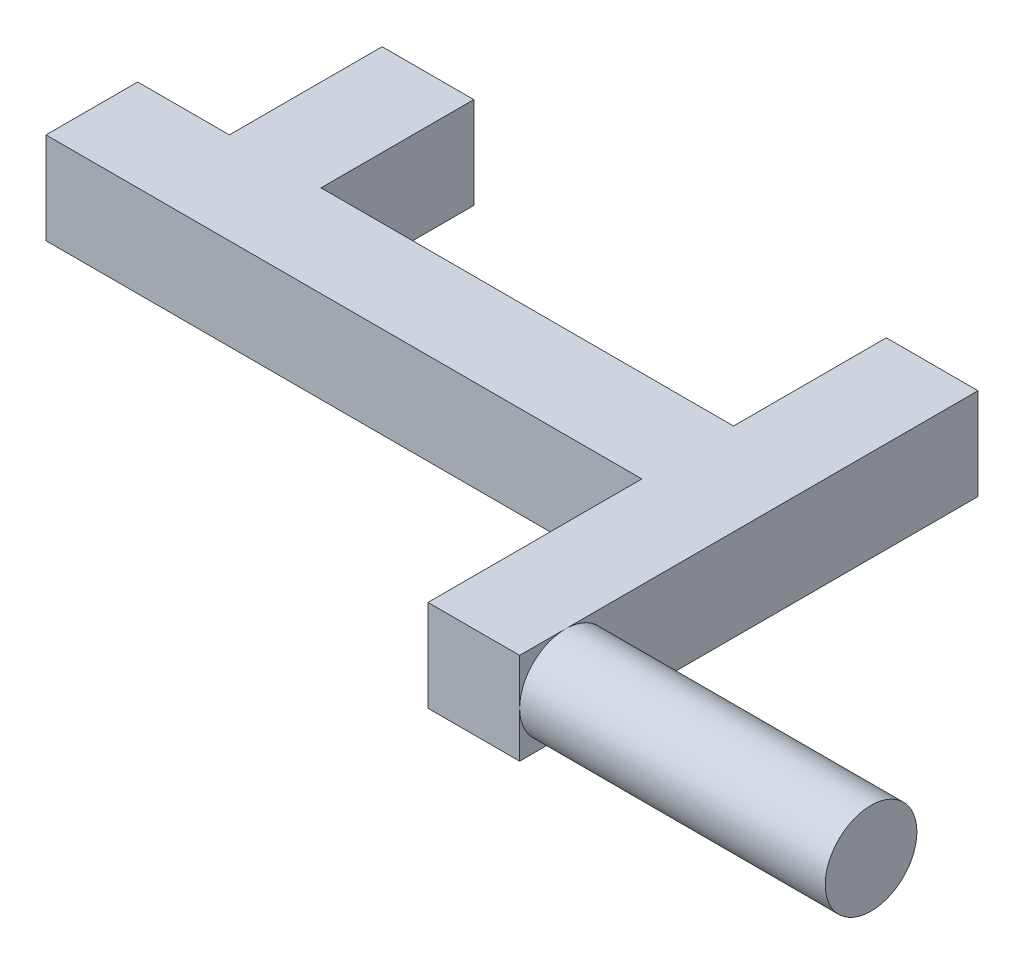
from build123d import *

# Parameters (mm, degrees)
RESSALTO_EXTRUS_O3_DEPTH = 6
CORTE_EXTRUS_O1_DEPTH    = 20


with BuildPart() as part:
    # Esboço1 → Ressalto-extrusão3 (new body)
    with BuildSketch(Plane(origin=(0, 0, 0), x_dir=(1, 0, 0), z_dir=(0, 1, 0))):
        Polygon((12, -10), (6, -10), (6, -16), (45, -16), (45, -30), (71, -30), (71, -24), (51, -24), (51, 0), (45, 0), (45, -10), (18, -10), (18, 0), (12, 0), align=None)
    extrude(amount=RESSALTO_EXTRUS_O3_DEPTH)

    # Esboço2 → Corte-extrusão1 (cut)
    with BuildSketch(Plane(origin=(71, 0, 0), x_dir=(0, 0, -1), z_dir=(1, 0, 0))):
        with BuildLine():
            Line((-30, 6), (-30, 3))
            ThreePointArc((-30, 3), (-29.121320344, 5.121320344), (-27, 6))
            Line((-27, 6), (-30, 6))
        make_face()
        with BuildLine():
            Line((-24, 6), (-27, 6))
            ThreePointArc((-27, 6), (-24.878679656, 5.121320344), (-24, 3))
            Line((-24, 3), (-24, 6))
        make_face()
        with BuildLine():
            ThreePointArc((-24, 3), (-24.878679656, 0.878679656), (-27, 0))
            Line((-27, 0), (-24, 0))
            Line((-24, 0), (-24, 3))
        make_face()
        with BuildLine():
            ThreePointArc((-27, 0), (-29.121320344, 0.878679656), (-30, 3))
            Line((-30, 3), (-30, 0))
            Line((-30, 0), (-27, 0))
        make_face()
    extrude(amount=-CORTE_EXTRUS_O1_DEPTH, mode=Mode.SUBTRACT)


solid = part.part
